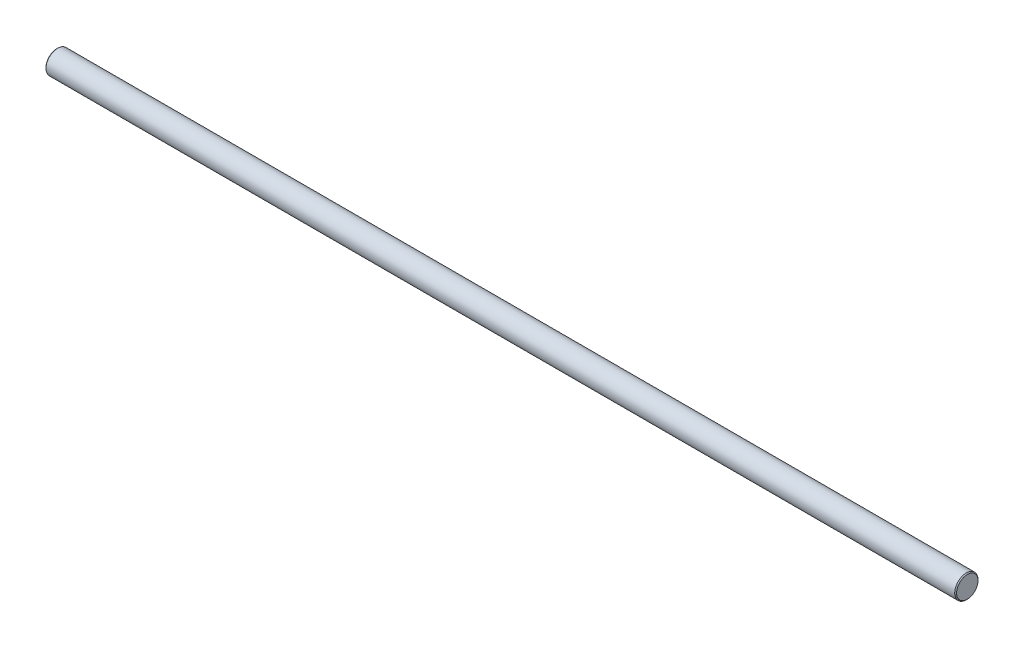
from build123d import *

# Parameters (mm, degrees)
SKETCH1_R           = 6.34365
BOSS_EXTRUDE1_DEPTH = 247.65
CHAMFER1_SIZE       = 0.508


with BuildPart() as part:
    # Sketch1 → Boss-Extrude1 (new, symmetric)
    with BuildSketch(Plane(origin=(0, 0, 0), x_dir=(0, 0, -1), z_dir=(1, 0, 0))):
        Circle(SKETCH1_R)
    extrude(amount=BOSS_EXTRUDE1_DEPTH, both=True)

    # Chamfer1
    chamfer1_edges = [part.edges().sort_by_distance(p)[0] for p in [
        (-247.65, 0, 6.34365),
        (247.65, 0, 6.34365),
    ]]
    chamfer(chamfer1_edges, length=CHAMFER1_SIZE)


solid = part.part
